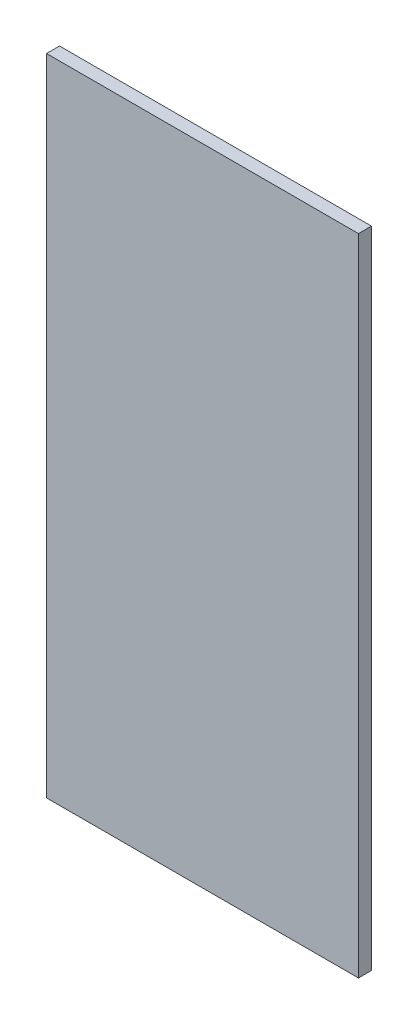
from build123d import *

# Parameters (mm, degrees)
SKETCH1_W           = 152.4
SKETCH1_H           = 314.96
BOSS_EXTRUDE1_DEPTH = 6.35


with BuildPart() as part:
    # Sketch1 → Boss-Extrude1 (new body)
    with BuildSketch(Plane.XY):
        Rectangle(SKETCH1_W, SKETCH1_H)
    extrude(amount=BOSS_EXTRUDE1_DEPTH)


solid = part.part
